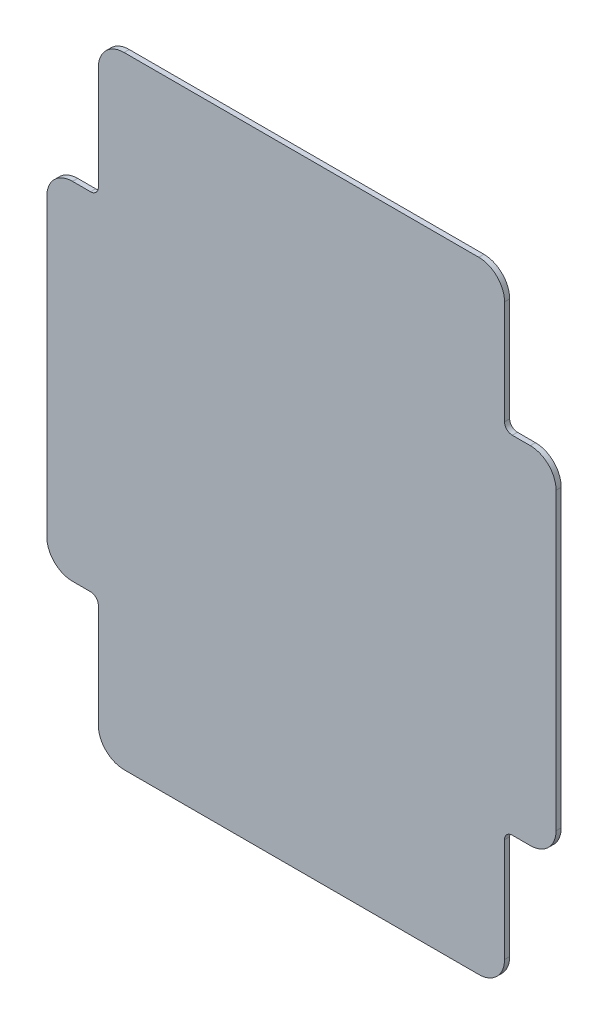
from build123d import *

# Parameters (mm, degrees)
Y_KSEKLIK_EKSTR_ZYON1_DEPTH = 2
RADYUS1_R                   = 10
RADYUS2_R                   = 3


with BuildPart() as part:
    # Çizim1 → Yükseklik-Ekstrüzyon1 (new body)
    with BuildSketch(Plane.XY):
        Polygon((78.397764574, 53), (78.397764574, 58), (-79.202235426, 58), (-79.202235426, 53), (-79.202235426, 4.7), (-99.202235426, 4.7), (-99.202235426, -129.7), (-79.202235426, -129.7), (-79.202235426, -178), (-79.202235426, -183), (78.397764574, -183), (78.397764574, -178), (78.397764574, -129.7), (98.397764574, -129.7), (98.397764574, 4.7), (78.397764574, 4.7), align=None)
    extrude(amount=Y_KSEKLIK_EKSTR_ZYON1_DEPTH)

    # Radyus1
    radyus1_edges = [part.edges().sort_by_distance(p)[0] for p in [
        (-79.202235426, 58, 1),
        (78.397764574, 58, 1),
        (98.397764574, 4.7, 1),
        (98.397764574, -129.7, 1),
        (78.397764574, -183, 1),
        (-79.202235426, -183, 1),
        (-99.202235426, -129.7, 1),
        (-99.202235426, 4.7, 1),
    ]]
    fillet(radyus1_edges, radius=RADYUS1_R)

    # Radyus2
    radyus2_edges = [part.edges().sort_by_distance(p)[0] for p in [
        (78.397764574, 4.7, 1),
        (78.397764574, -129.7, 1),
        (-79.202235426, -129.7, 1),
        (-79.202235426, 4.7, 1),
    ]]
    fillet(radyus2_edges, radius=RADYUS2_R)


solid = part.part
